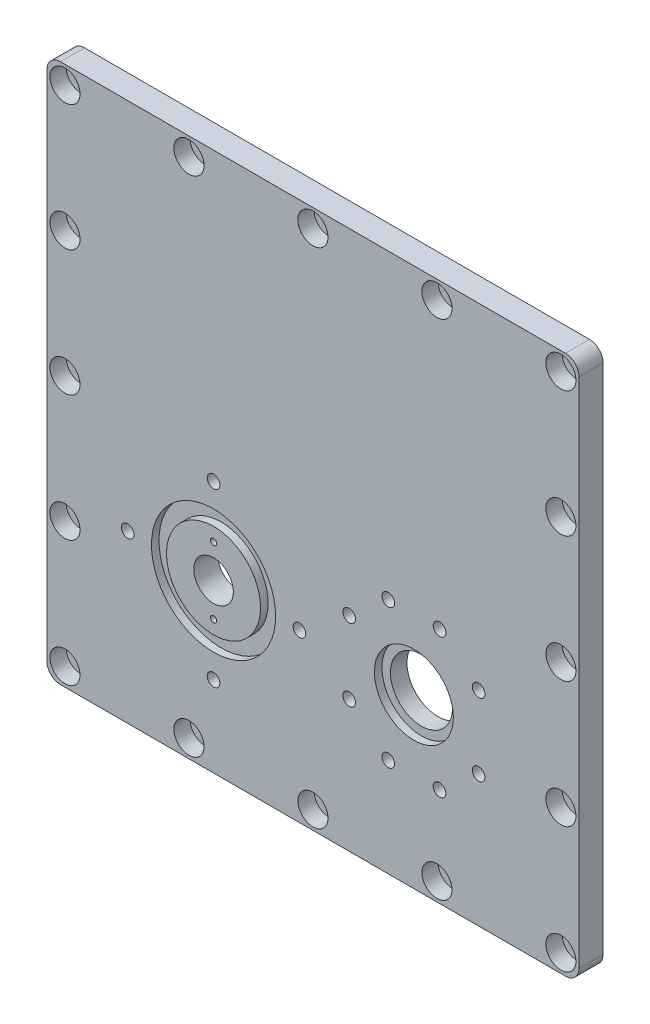
from build123d import *

# Parameters (mm, degrees)
BOSS_EXTRUDE1_DEPTH = 8
CUT_EXTRUDE1_DEPTH  = 90
SKETCH3_R           = 5
CUT_EXTRUDE2_DEPTH  = 5.4
SKETCH5_R           = 10.3
CUT_EXTRUDE3_DEPTH  = 20
SKETCH7_R           = 20.6
SKETCH7_R_2         = 15.6
CUT_EXTRUDE5_DEPTH  = 2.5
CUT_EXTRUDE6_REACH  = 127.974
SKETCH9_R           = 6.575
SKETCH9_R_2         = 2.1
SKETCH9_R_3         = 1.025
SKETCH10_R          = 2.1
CUT_EXTRUDE10_DEPTH = 10
CUT_EXTRUDE11_DEPTH = 2.5
BOSS_EXTRUDE2_START = -1
SKETCH12_R          = 1.025
BOSS_EXTRUDE2_DEPTH = 1
FILLET1_R           = 0.5


with BuildPart() as part:
    # Sketch1 → Boss-Extrude1 (new body)
    with BuildSketch(Plane.XY):
        with BuildLine():
            Line((-83.790627288, -89.5), (83.790627288, -89.5))
            ThreePointArc((83.790627288, -89.5), (86.972607803, -88.181980515), (88.290627288, -85))
            Line((88.290627288, -85), (88.290627288, 85))
            ThreePointArc((88.290627288, 85), (86.972607803, 88.181980515), (83.790627288, 89.5))
            Line((83.790627288, 89.5), (-83.790627288, 89.5))
            ThreePointArc((-83.790627288, 89.5), (-86.972607803, 88.181980515), (-88.290627288, 85))
            Line((-88.290627288, 85), (-88.290627288, -85))
            ThreePointArc((-88.290627288, -85), (-86.972607803, -88.181980515), (-83.790627288, -89.5))
        make_face()
    extrude(amount=BOSS_EXTRUDE1_DEPTH)

    # Sketch2 → Cut-Extrude1 (cut)
    with BuildSketch(Plane.XY.offset(8)):
        with BuildLine():
            ThreePointArc((43.745313644, 83.5), (41.145313644, 86.1), (38.545313644, 83.5))
            ThreePointArc((38.545313644, 83.5), (41.145313644, 80.9), (43.745313644, 83.5))
        make_face()
        with BuildLine():
            Line((0, 84), (2.551470164, 84))
            ThreePointArc((2.551470164, 84), (0, 86.1), (-2.551470164, 84))
            Line((-2.551470164, 84), (0, 84))
        make_face()
        with BuildLine():
            Line((0, 84), (-2.551470164, 84))
            ThreePointArc((-2.551470164, 84), (0, 80.9), (2.551470164, 84))
            Line((2.551470164, 84), (0, 84))
        make_face()
        with BuildLine():
            ThreePointArc((-43.745313644, 83.5), (-41.145313644, 80.9), (-38.545313644, 83.5))
            ThreePointArc((-38.545313644, 83.5), (-41.145313644, 86.1), (-43.745313644, 83.5))
        make_face()
        with BuildLine():
            ThreePointArc((-84.890627288, 83.5), (-82.290627288, 80.9), (-79.690627288, 83.5))
            ThreePointArc((-79.690627288, 83.5), (-82.290627288, 86.1), (-84.890627288, 83.5))
        make_face()
        with BuildLine():
            ThreePointArc((-84.890627288, 41.75), (-82.290627288, 39.15), (-79.690627288, 41.75))
            ThreePointArc((-79.690627288, 41.75), (-82.290627288, 44.35), (-84.890627288, 41.75))
        make_face()
        with BuildLine():
            ThreePointArc((-84.890627288, 0), (-82.290627288, -2.6), (-79.690627288, 0))
            ThreePointArc((-79.690627288, 0), (-82.290627288, 2.6), (-84.890627288, 0))
        make_face()
        with BuildLine():
            ThreePointArc((-79.690627288, -83.5), (-82.290627288, -80.9), (-84.890627288, -83.5))
            ThreePointArc((-84.890627288, -83.5), (-82.290627288, -86.1), (-79.690627288, -83.5))
        make_face()
        with BuildLine():
            ThreePointArc((-84.890627288, -41.75), (-82.290627288, -44.35), (-79.690627288, -41.75))
            ThreePointArc((-79.690627288, -41.75), (-82.290627288, -39.15), (-84.890627288, -41.75))
        make_face()
        with BuildLine():
            ThreePointArc((-43.745313644, -83.5), (-41.145313644, -86.1), (-38.545313644, -83.5))
            ThreePointArc((-38.545313644, -83.5), (-41.145313644, -80.9), (-43.745313644, -83.5))
        make_face()
        with BuildLine():
            ThreePointArc((-2.6, -83.5), (0, -86.1), (2.6, -83.5))
            ThreePointArc((2.6, -83.5), (0, -80.9), (-2.6, -83.5))
        make_face()
        with BuildLine():
            ThreePointArc((38.545313644, -83.5), (41.145313644, -86.1), (43.745313644, -83.5))
            ThreePointArc((43.745313644, -83.5), (41.145313644, -80.9), (38.545313644, -83.5))
        make_face()
        with BuildLine():
            ThreePointArc((79.690627288, -83.5), (82.290627288, -86.1), (84.890627288, -83.5))
            ThreePointArc((84.890627288, -83.5), (82.290627288, -80.9), (79.690627288, -83.5))
        make_face()
        with BuildLine():
            ThreePointArc((79.690627288, -41.75), (82.290627288, -44.35), (84.890627288, -41.75))
            ThreePointArc((84.890627288, -41.75), (82.290627288, -39.15), (79.690627288, -41.75))
        make_face()
        with BuildLine():
            ThreePointArc((79.690627288, 0), (82.290627288, -2.6), (84.890627288, 0))
            ThreePointArc((84.890627288, 0), (82.290627288, 2.6), (79.690627288, 0))
        make_face()
        with BuildLine():
            ThreePointArc((79.690627288, 41.75), (82.290627288, 39.15), (84.890627288, 41.75))
            ThreePointArc((84.890627288, 41.75), (82.290627288, 44.35), (79.690627288, 41.75))
        make_face()
        with BuildLine():
            ThreePointArc((79.690627288, 83.5), (82.290627288, 80.9), (84.890627288, 83.5))
            ThreePointArc((84.890627288, 83.5), (82.290627288, 86.1), (79.690627288, 83.5))
        make_face()
    extrude(amount=-CUT_EXTRUDE1_DEPTH, mode=Mode.SUBTRACT)

    # Sketch3 → Cut-Extrude2 (cut)
    with BuildSketch(Plane.XY.offset(8)):
        with Locations((41.145313644, 83.5)):
            Circle(SKETCH3_R)
        with Locations((82.290627288, 83.5)):
            Circle(SKETCH3_R)
        with Locations((82.290627288, 41.75)):
            Circle(SKETCH3_R)
        with Locations((82.290627288, 0)):
            Circle(SKETCH3_R)
        with Locations((82.290627288, -41.75)):
            Circle(SKETCH3_R)
        with Locations((82.290627288, -83.5)):
            Circle(SKETCH3_R)
        with Locations((41.145313644, -83.5)):
            Circle(SKETCH3_R)
        with Locations((0, -83.5)):
            Circle(SKETCH3_R)
        with Locations((-82.290627288, 0)):
            Circle(SKETCH3_R)
        with Locations((-82.290627288, -83.5)):
            Circle(SKETCH3_R)
        with Locations((-82.290627288, -41.75)):
            Circle(SKETCH3_R)
        with Locations((-41.145313644, -83.5)):
            Circle(SKETCH3_R)
        with Locations((-82.290627288, 41.75)):
            Circle(SKETCH3_R)
        with Locations((-82.290627288, 83.5)):
            Circle(SKETCH3_R)
        with Locations((-41.145313644, 83.5)):
            Circle(SKETCH3_R)
        with Locations((0, 83.5)):
            Circle(SKETCH3_R)
    extrude(amount=-CUT_EXTRUDE2_DEPTH, mode=Mode.SUBTRACT)

    # Sketch5 → Cut-Extrude3 (cut)
    with BuildSketch(Plane.XY.offset(8)):
        with Locations((33.49662103, -33.754772237)):
            Circle(SKETCH5_R)
    extrude(amount=-CUT_EXTRUDE3_DEPTH, mode=Mode.SUBTRACT)

    # Sketch7 → Cut-Extrude5 (cut)
    with BuildSketch(Plane.XY.offset(8)):
        with Locations((-32.990627288, -34.2)):
            Circle(SKETCH7_R)
        with Locations((-32.990627288, -34.2)):
            Circle(SKETCH7_R_2, mode=Mode.SUBTRACT)
    extrude(amount=-CUT_EXTRUDE5_DEPTH, mode=Mode.SUBTRACT)

    # Sketch9 → Cut-Extrude6 (cut, up to next)
    with BuildSketch(Plane.XY.offset(8), mode=Mode.PRIVATE) as cut_extrude6_sk1:
        with Locations((-32.990627288, -34.2)):
            Circle(SKETCH9_R)
    cut_extrude6_tool1 = extrude(cut_extrude6_sk1.sketch, amount=-CUT_EXTRUDE6_REACH, mode=Mode.PRIVATE) & part.part
    # Sketch9 → Cut-Extrude6 (cut, up to next)
    with BuildSketch(Plane.XY.offset(8), mode=Mode.PRIVATE) as cut_extrude6_sk2:
        with Locations((-32.990627288, -5.7)):
            Circle(SKETCH9_R_2)
    cut_extrude6_tool2 = extrude(cut_extrude6_sk2.sketch, amount=-CUT_EXTRUDE6_REACH, mode=Mode.PRIVATE) & part.part
    # Sketch9 → Cut-Extrude6 (cut, up to next)
    with BuildSketch(Plane.XY.offset(8), mode=Mode.PRIVATE) as cut_extrude6_sk3:
        with Locations((-32.990627288, -23.0748)):
            Circle(SKETCH9_R_3)
    cut_extrude6_tool3 = extrude(cut_extrude6_sk3.sketch, amount=-CUT_EXTRUDE6_REACH, mode=Mode.PRIVATE) & part.part
    # Sketch9 → Cut-Extrude6 (cut, up to next)
    with BuildSketch(Plane.XY.offset(8), mode=Mode.PRIVATE) as cut_extrude6_sk4:
        with Locations((-32.990627288, -45.3252)):
            Circle(SKETCH9_R_3)
    cut_extrude6_tool4 = extrude(cut_extrude6_sk4.sketch, amount=-CUT_EXTRUDE6_REACH, mode=Mode.PRIVATE) & part.part
    # Sketch9 → Cut-Extrude6 (cut, up to next)
    with BuildSketch(Plane.XY.offset(8), mode=Mode.PRIVATE) as cut_extrude6_sk5:
        with Locations((-4.490627288, -34.2)):
            Circle(SKETCH9_R_2)
    cut_extrude6_tool5 = extrude(cut_extrude6_sk5.sketch, amount=-CUT_EXTRUDE6_REACH, mode=Mode.PRIVATE) & part.part
    # Sketch9 → Cut-Extrude6 (cut, up to next)
    with BuildSketch(Plane.XY.offset(8), mode=Mode.PRIVATE) as cut_extrude6_sk6:
        with Locations((-32.990627288, -62.7)):
            Circle(SKETCH9_R_2)
    cut_extrude6_tool6 = extrude(cut_extrude6_sk6.sketch, amount=-CUT_EXTRUDE6_REACH, mode=Mode.PRIVATE) & part.part
    # Sketch9 → Cut-Extrude6 (cut, up to next)
    with BuildSketch(Plane.XY.offset(8), mode=Mode.PRIVATE) as cut_extrude6_sk7:
        with Locations((-61.490627288, -34.2)):
            Circle(SKETCH9_R_2)
    cut_extrude6_tool7 = extrude(cut_extrude6_sk7.sketch, amount=-CUT_EXTRUDE6_REACH, mode=Mode.PRIVATE) & part.part
    add(cut_extrude6_tool1.solids().sort_by_distance((-32.990627, -34.2, 8))[0], mode=Mode.SUBTRACT)
    add(cut_extrude6_tool2.solids().sort_by_distance((-32.990627, -5.7, 8))[0], mode=Mode.SUBTRACT)
    add(cut_extrude6_tool3.solids().sort_by_distance((-32.990627, -23.0748, 8))[0], mode=Mode.SUBTRACT)
    add(cut_extrude6_tool4.solids().sort_by_distance((-32.990627, -45.3252, 8))[0], mode=Mode.SUBTRACT)
    add(cut_extrude6_tool5.solids().sort_by_distance((-4.490627, -34.2, 8))[0], mode=Mode.SUBTRACT)
    add(cut_extrude6_tool6.solids().sort_by_distance((-32.990627, -62.7, 8))[0], mode=Mode.SUBTRACT)
    add(cut_extrude6_tool7.solids().sort_by_distance((-61.490627, -34.2, 8))[0], mode=Mode.SUBTRACT)

    # Sketch10 → Cut-Extrude10 (cut)
    with BuildSketch(Plane.XY.offset(8)):
        with Locations((54.971257232, -21.754772237)):
            Circle(SKETCH10_R)
        with Locations((41.99662103, -10.669928724)):
            Circle(SKETCH10_R)
        with Locations((24.99662103, -10.669928724)):
            Circle(SKETCH10_R)
        with Locations((12.021984828, -21.754772237)):
            Circle(SKETCH10_R)
        with Locations((12.021984828, -45.754772237)):
            Circle(SKETCH10_R)
        with Locations((24.99662103, -56.839615749)):
            Circle(SKETCH10_R)
        with Locations((41.99662103, -56.839615749)):
            Circle(SKETCH10_R)
        with Locations((54.971257232, -45.754772237)):
            Circle(SKETCH10_R)
    extrude(amount=-CUT_EXTRUDE10_DEPTH, mode=Mode.SUBTRACT)

    # Sketch11 → Cut-Extrude11 (cut)
    with BuildSketch(Plane.XY.offset(8)):
        with BuildLine():
            ThreePointArc((33.49662103, -20.654772237), (20.39662103, -33.754772237), (33.49662103, -46.854772237))
            ThreePointArc((33.49662103, -46.854772237), (46.59662103, -33.754772237), (33.49662103, -20.654772237))
        make_face()
    extrude(amount=-CUT_EXTRUDE11_DEPTH, mode=Mode.SUBTRACT)

    # Sketch12 → Boss-Extrude2 (add)
    with BuildSketch(Plane(origin=(0, 0, 0), x_dir=(-1, 0, 0), z_dir=(0, 0, -1)).offset(BOSS_EXTRUDE2_START)):
        with Locations(Location((32.990627288, -23.0748, 0), (0, 0, 180))):
            Circle(SKETCH12_R)
        with Locations(Location((32.990627288, -45.3252, 0), (0, 0, 180))):
            Circle(SKETCH12_R)
    extrude(amount=BOSS_EXTRUDE2_DEPTH)

    # Fillet1
    fillet1_edges = [part.edges().sort_by_distance(p)[0] for p in [
        (-34.015627288, -23.0748, 1),
        (-34.015627288, -45.3252, 1),
    ]]
    fillet(fillet1_edges, radius=FILLET1_R)


solid = part.part
